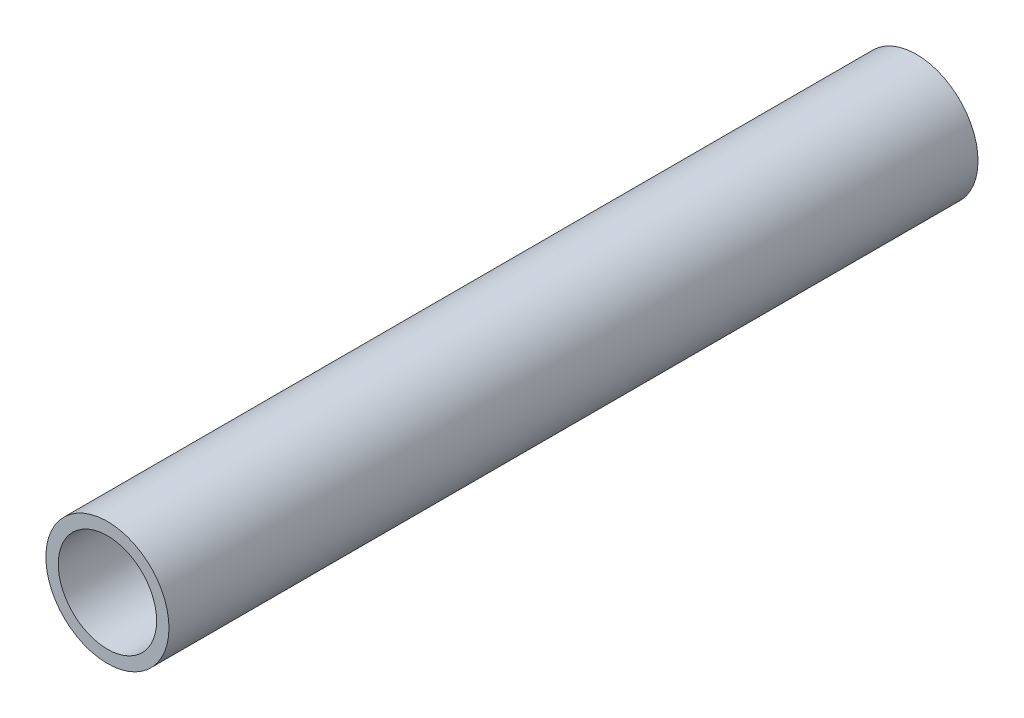
from build123d import *

# Parameters (mm, degrees)
CROQUIS1_R              = 10.65
CROQUIS1_R_2            = 8.51
SALIENTE_EXTRUIR1_DEPTH = 140


with BuildPart() as part:
    # Croquis1 → Saliente-Extruir1 (new body)
    with BuildSketch(Plane.XY):
        Circle(CROQUIS1_R)
        Circle(CROQUIS1_R_2, mode=Mode.SUBTRACT)
    extrude(amount=SALIENTE_EXTRUIR1_DEPTH)


solid = part.part
